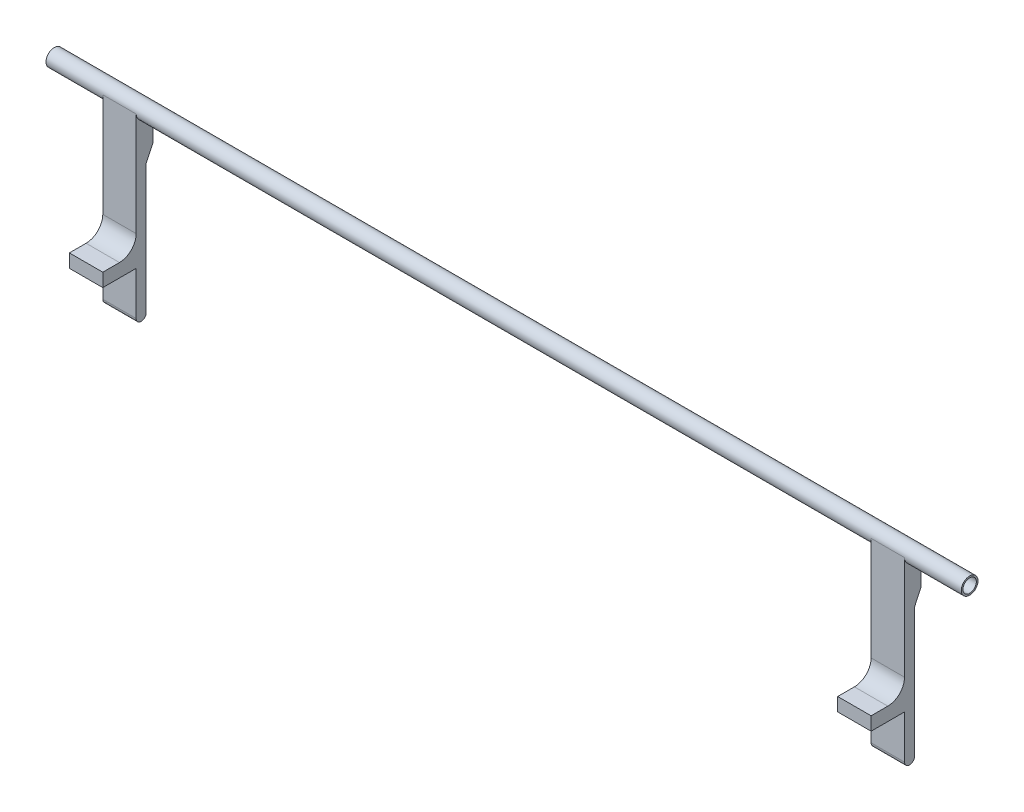
from build123d import *

# Parameters (mm, degrees)
SKETCH_1_R      = 2.5
SKETCH_1_R_2    = 2
EXTRUDE_1_DEPTH = 137
EXTRUDE_2_DEPTH = 10


with BuildPart() as part:
    # 草圖1 → 填料-伸長1 (new, symmetric)
    with BuildSketch(Plane(origin=(0, 0, 0), x_dir=(0, 0, -1), z_dir=(1, 0, 0))):
        Circle(SKETCH_1_R)
        Circle(SKETCH_1_R_2, mode=Mode.SUBTRACT)
    extrude(amount=EXTRUDE_1_DEPTH, both=True)

    # 草圖3 → 填料-伸長2 (add)
    with BuildSketch(Plane(origin=(120, 0, 0), x_dir=(0, 0, -1), z_dir=(1, 0, 0))):
        with BuildLine():
            Line((2.5, 0), (2.5, -10))
            Line((2.5, -10), (0.5, -14.289013841))
            Line((0.5, -14.289013841), (0.5, -53))
            ThreePointArc((0.5, -53), (-1, -54.5), (-2.5, -53))
            Line((-2.5, -53), (-2.5, -40))
            Line((-2.5, -40), (-12.5, -40))
            Line((-12.5, -40), (-12.5, -36))
            Line((-12.5, -36), (-7.5, -36))
            ThreePointArc((-7.5, -36), (-3.964466094, -34.535533906), (-2.5, -31))
            Line((-2.5, -31), (-2.5, 0))
            ThreePointArc((-2.5, 0), (0, -2.5), (2.5, 0))
        make_face()
    extrude_2 = extrude(amount=-EXTRUDE_2_DEPTH)

    # 鏡射1: 填料-伸長2 across plane
    add(extrude_2.mirror(Plane(origin=(0, 0, 0), x_dir=(0, 0, 1), z_dir=(1, 0, 0))))


solid = part.part
